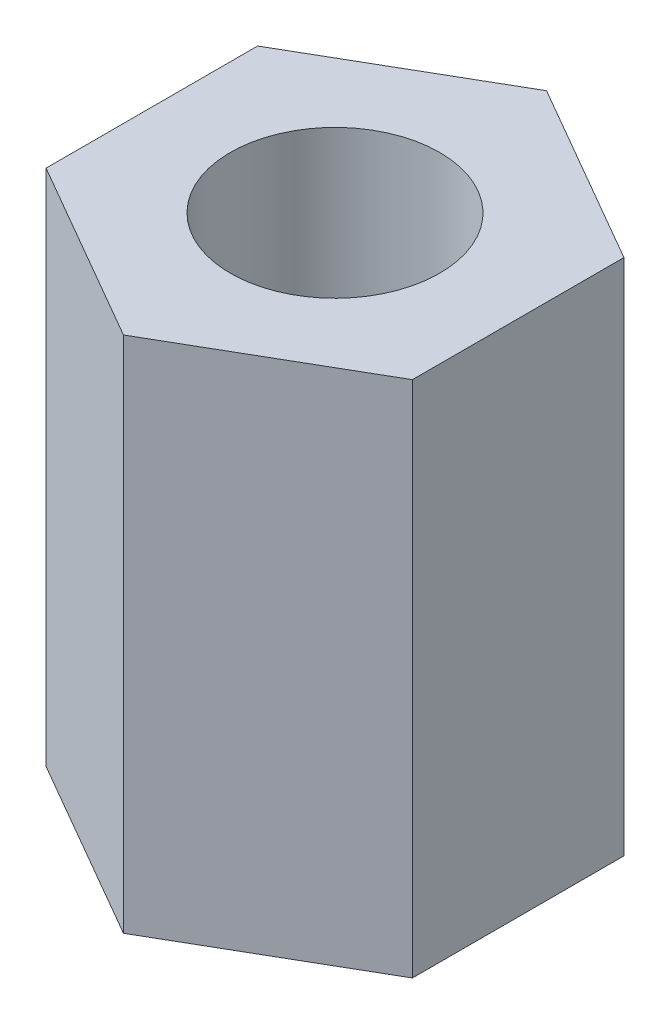
from build123d import *

# Parameters (mm, degrees)
SKETCH1_R           = 2
BOSS_EXTRUDE1_DEPTH = 9.9


with BuildPart() as part:
    # Sketch1 → Boss-Extrude1 (new body)
    with BuildSketch(Plane(origin=(0, 0, 0), x_dir=(1, 0, 0), z_dir=(0, 1, 0))):
        Polygon((-3.5, -2.020725942), (0, -4.041451884), (3.5, -2.020725942), (3.5, 2.020725942), (0, 4.041451884), (-3.5, 2.020725942), align=None)
        with Locations(Location((0, 0, 0), (0, 0, 90))):
            Circle(SKETCH1_R, mode=Mode.SUBTRACT)
    extrude(amount=BOSS_EXTRUDE1_DEPTH)


solid = part.part
